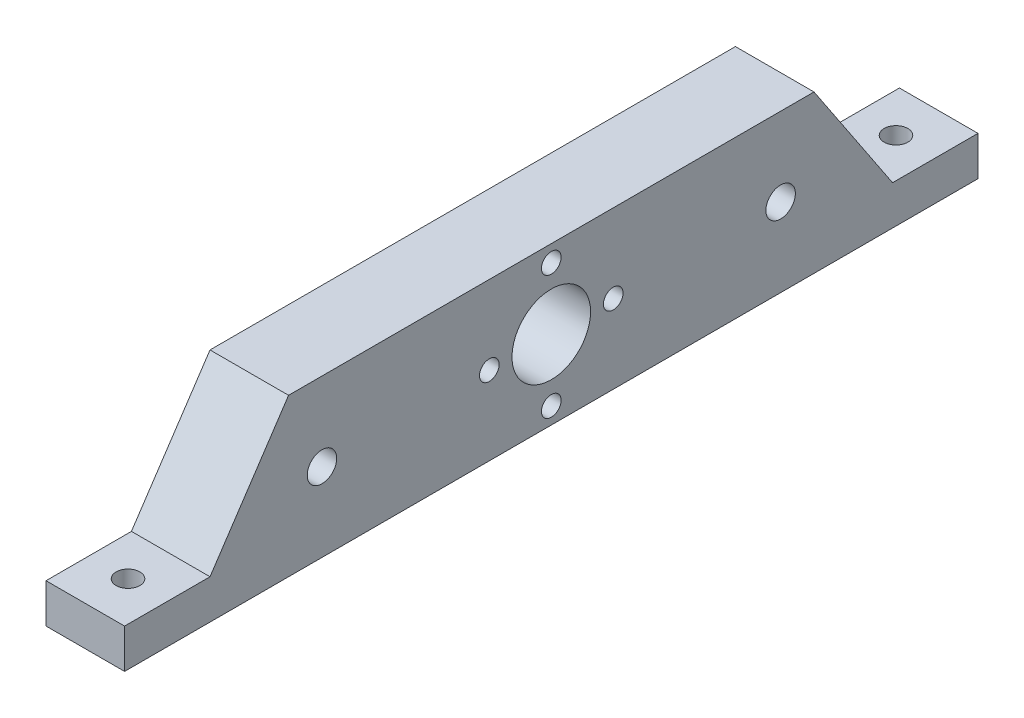
from build123d import *

# Parameters (mm, degrees)
SKETCH2_W               = 380
SKETCH2_H               = 40
SKETCH2_R               = 10
SKETCH2_R_2             = 3.75
BOSS_EXTRUDE2_DEPTH     = 20
CUT_EXTRUDE1_DEPTH      = 100
CUT_EXTRUDE2_DEPTH      = 301.779846116
CUT_EXTRUDE2_DEPTH_BACK = 301.779846116
SKETCH5_R               = 3.023423491
SKETCH8_R               = 2.5
CUT_EXTRUDE3_DEPTH      = 302.941245658


with BuildPart() as part:
    # Sketch2 → Boss-Extrude2 (new body)
    with BuildSketch(Plane(origin=(0, 0, 0), x_dir=(0, 0, -1), z_dir=(1, 0, 0))):
        with Locations((190, 20)):
            Rectangle(SKETCH2_W, SKETCH2_H)
        with Locations((190, 20)):
            Circle(SKETCH2_R, mode=Mode.SUBTRACT)
        with Locations((131.63, 20)):
            Circle(SKETCH2_R_2, mode=Mode.SUBTRACT)
        with Locations((248.37, 20)):
            Circle(SKETCH2_R_2, mode=Mode.SUBTRACT)
    extrude(amount=BOSS_EXTRUDE2_DEPTH)

    # Sketch4 → Cut-Extrude1 (cut)
    with BuildSketch(Plane(origin=(20, 0, 0), x_dir=(0, 0, -1), z_dir=(1, 0, 0))):
        Polygon((123.129236316, 40), (0, 40), (0, 0), (81.389022591, 0), (81.389022591, 10), (103.1360247, 10), align=None)
        Polygon((298.610977409, 10), (298.610977409, 0), (380, 0), (380, 40), (256.870763684, 40), (276.8639753, 10), align=None)
    extrude(amount=-CUT_EXTRUDE1_DEPTH, mode=Mode.SUBTRACT)

    # Sketch5 → Cut-Extrude2 (cut, two sides: drawn at the far end of the back side and taken through both)
    with BuildSketch(Plane(origin=(0, 10, 0), x_dir=(1, 0, 0), z_dir=(0, 1, 0)).offset(-CUT_EXTRUDE2_DEPTH_BACK)):
        with Locations(Location((10, 92.262523645, 0), (0, 0, 270))):
            Circle(SKETCH5_R)
        with Locations(Location((10, 287.737476355, 0), (0, 0, 90))):
            Circle(SKETCH5_R)
    extrude(amount=CUT_EXTRUDE2_DEPTH + CUT_EXTRUDE2_DEPTH_BACK, mode=Mode.SUBTRACT)

    # Sketch8 → Cut-Extrude3 (cut, through all)
    with BuildSketch(Plane(origin=(20, 0, 0), x_dir=(0, 0, -1), z_dir=(1, 0, 0))):
        with Locations((190, 35.7650867)):
            Circle(SKETCH8_R)
        with Locations(Location((190, 4.2349133, 0), (0, 0, 180))):
            Circle(SKETCH8_R)
        with Locations((174.23, 20)):
            Circle(SKETCH8_R)
        with Locations(Location((205.77, 20, 0), (0, 0, 180))):
            Circle(SKETCH8_R)
    extrude(amount=-CUT_EXTRUDE3_DEPTH, mode=Mode.SUBTRACT)


solid = part.part
